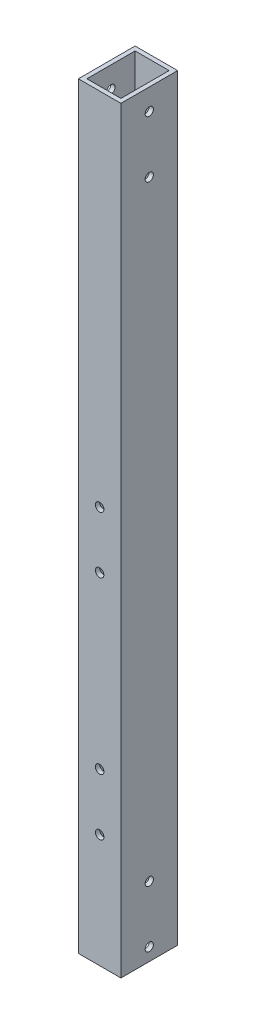
from build123d import *

# Parameters (mm, degrees)
SKETCH_1_W          = 15
SKETCH_1_H          = 20
SKETCH_1_W_2        = 12
SKETCH_1_H_2        = 17
EXTRUDE_1_DEPTH     = 267
SKETCH_4_R          = 1.45
CUT_EXTRUDE_2_DEPTH = 268.607922155
SKETCH_5_R          = 1.5
CUT_EXTRUDE_3_DEPTH = 268.853038064


with BuildPart() as part:
    # 草图1 → 拉伸-薄壁1 (new body)
    with BuildSketch(Plane(origin=(0, 0, 0), x_dir=(1, 0, 0), z_dir=(0, 1, 0))):
        Rectangle(SKETCH_1_W, SKETCH_1_H)
        Rectangle(SKETCH_1_W_2, SKETCH_1_H_2, mode=Mode.SUBTRACT)
    extrude(amount=EXTRUDE_1_DEPTH)

    # 草图4 → 切除-拉伸2 (cut, through all)
    with BuildSketch(Plane(origin=(7.5, 0, 0), x_dir=(0, 0, -1), z_dir=(1, 0, 0))):
        with Locations((0, 259.5)):
            Circle(SKETCH_4_R)
        with Locations((0, 239.5)):
            Circle(SKETCH_4_R)
        with Locations((0, 24.5)):
            Circle(SKETCH_4_R)
        with Locations((0, 4.5)):
            Circle(SKETCH_4_R)
    extrude(amount=-CUT_EXTRUDE_2_DEPTH, mode=Mode.SUBTRACT)

    # 草图5 → 切除-拉伸3 (cut, through all)
    with BuildSketch(Plane.XY.offset(10)):
        with Locations((0, 40)):
            Circle(SKETCH_5_R)
        with Locations((0, 60)):
            Circle(SKETCH_5_R)
        with Locations((0, 120)):
            Circle(SKETCH_5_R)
        with Locations((0, 140)):
            Circle(SKETCH_5_R)
    extrude(amount=-CUT_EXTRUDE_3_DEPTH, mode=Mode.SUBTRACT)


solid = part.part
